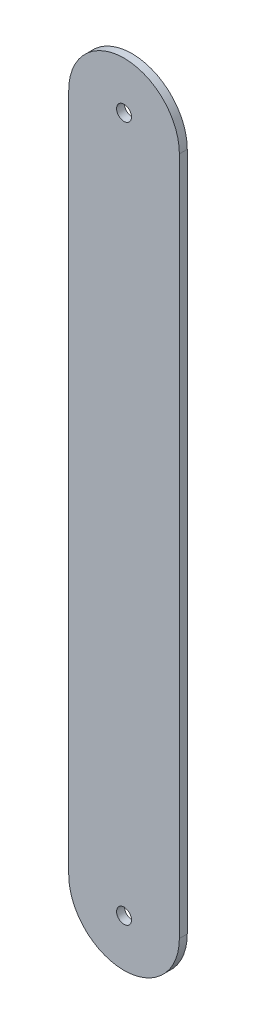
from build123d import *

# Parameters (mm, degrees)
SKETCH1_R           = 1.5
SKETCH1_W           = 11.1125
SKETCH1_H           = 136.525
BOSS_EXTRUDE1_DEPTH = 1.5875


with BuildPart() as part:
    # Sketch1 → Boss-Extrude1 (new body)
    # profile 1 of 4: a face of its own
    with BuildSketch(Plane.XY):
        with BuildLine():
            ThreePointArc((-11.1125, 68.2625), (0, 79.375), (11.1125, 68.2625))
            Line((11.1125, 68.2625), (-11.1125, 68.2625))
        make_face()
        with Locations((0, 69.85)):
            Circle(SKETCH1_R, mode=Mode.SUBTRACT)
    # profile 2 of 4: a face of its own
    with BuildSketch(Plane.XY):
        with Locations((5.55625, 0)):
            Rectangle(SKETCH1_W, SKETCH1_H)
    # profile 3 of 4: a face of its own
    with BuildSketch(Plane.XY):
        with Locations((-5.55625, 0)):
            Rectangle(SKETCH1_W, SKETCH1_H)
    # profile 4 of 4: a face of its own
    with BuildSketch(Plane.XY):
        with BuildLine():
            Line((-11.1125, -68.2625), (11.1125, -68.2625))
            ThreePointArc((11.1125, -68.2625), (0, -79.375), (-11.1125, -68.2625))
        make_face()
        with Locations((0, -69.85)):
            Circle(SKETCH1_R, mode=Mode.SUBTRACT)
    extrude(amount=BOSS_EXTRUDE1_DEPTH)


solid = part.part
